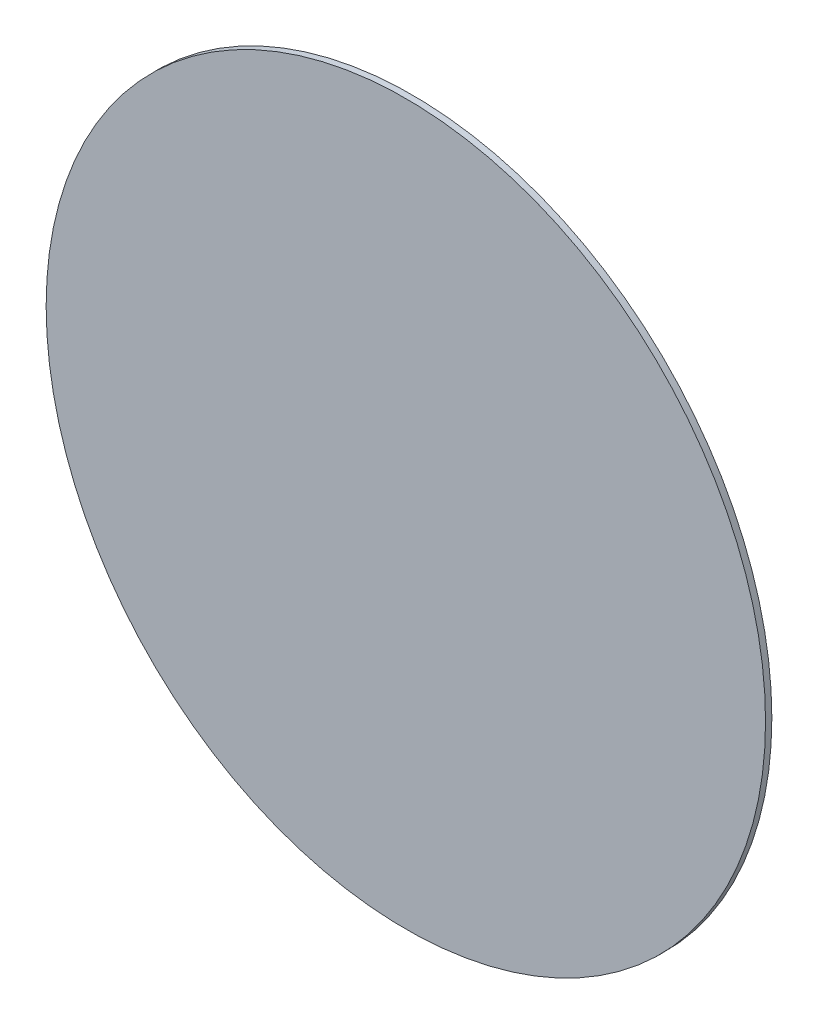
from build123d import *

# Parameters (mm, degrees)
SKETCH_1_R      = 114
EXTRUDE_1_DEPTH = 2


with BuildPart() as part:
    # 草图1 → 凸台-拉伸1 (new body)
    with BuildSketch(Plane.XY):
        Circle(SKETCH_1_R)
    extrude(amount=EXTRUDE_1_DEPTH)


solid = part.part
